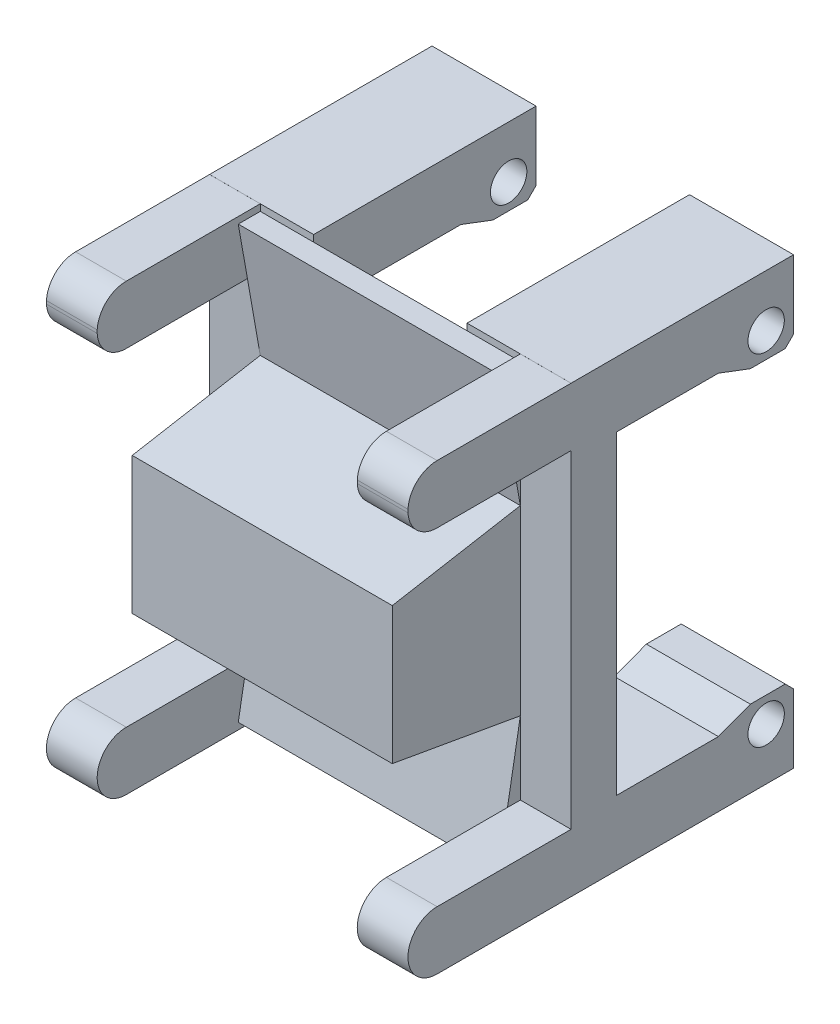
from build123d import *

# Parameters (mm, degrees)
SKETCH_1_W            = 27.8
SKETCH_1_H            = 24.2
EXTRUDE_1_DEPTH       = 5
SKETCH_5_R            = 1.4
EXTRUDE_5_DEPTH       = 8
SKETCH_8_W            = 1.5
SKETCH_8_H            = 34.2
CUT_EXTRUDE_1_DEPTH   = 30
EXTRUDE_11_DEPTH      = 10
EXTRUDE_11_DEPTH_BACK = 10
EXTRUDE_12_DEPTH      = 3.9


with BuildPart() as part:
    # 草图1 → 凸台-拉伸1 (new body)
    with BuildSketch(Plane.XY):
        Rectangle(SKETCH_1_W, SKETCH_1_H)
    extrude(amount=EXTRUDE_1_DEPTH)

    # 草图5 → 凸台-拉伸5 (add)
    # profile 1 of 2: a face of its own
    with BuildSketch(Plane.ZY.offset(13.9)):
        Polygon((-11.5, -11.168960062), (-12.967909623, -11.168960062), (-13.608884892, -11.809935331), (-13.608884892, -17.1), (-11.5, -17.1), (5, -17.1), (5, -12.1), (0, -12.1), (-7.82761802, -12.1), (-10.28681363, -11.168960062), align=None)
        with Locations((-11.5, -13.1)):
            Circle(SKETCH_5_R, mode=Mode.SUBTRACT)
    # profile 2 of 2: a face of its own
    with BuildSketch(Plane.ZY.offset(13.9)):
        Polygon((5, 12.1), (5, 17.1), (-11.5, 17.1), (-13.608884892, 17.1), (-13.608884892, 11.809935331), (-12.967909623, 11.168960062), (-11.5, 11.168960062), (-10.28681363, 11.168960062), (-7.82761802, 12.1), (0, 12.1), align=None)
        with Locations((-11.5, 13.1)):
            Circle(SKETCH_5_R, mode=Mode.SUBTRACT)
    extrude_5 = extrude(amount=-EXTRUDE_5_DEPTH)

    # 镜向1: 凸台-拉伸5 across plane
    add(extrude_5.mirror(Plane(origin=(0, 0, 0), x_dir=(0, 0, 1), z_dir=(1, 0, 0))))

    # 草图8 → 切除-拉伸1 (cut)
    with BuildSketch(Plane(origin=(13.9, 0, 0), x_dir=(0, 0, -1), z_dir=(1, 0, 0))):
        with Locations((-4.25, 0)):
            Rectangle(SKETCH_8_W, SKETCH_8_H)
    extrude(amount=-CUT_EXTRUDE_1_DEPTH, mode=Mode.SUBTRACT)

    # 草图10 → 凸台-拉伸11 (add, two sides: drawn at the far end of the back side and taken through both)
    with BuildSketch(Plane(origin=(0, 0, 0), x_dir=(0, 0, -1), z_dir=(1, 0, 0)).offset(-EXTRUDE_11_DEPTH_BACK)):
        Polygon((-3.5, -7), (-13.34807753, -5.263518223), (-13.34807753, 5.263518223), (-3.5, 7), align=None)
        Polygon((-3.5, 16.591331578), (-3.5, 7), (-5.191210538, 16.591331578), align=None)
        Polygon((-5.191210538, -16.591331578), (-3.5, -16.591331578), (-3.5, -7), align=None)
    extrude(amount=EXTRUDE_11_DEPTH + EXTRUDE_11_DEPTH_BACK)

    # 草图11 → 凸台-拉伸12 (add)
    with BuildSketch(Plane.ZY.offset(10)):
        with BuildLine():
            Line((5.191210538, 16.591331578), (4.489460182, 12.611507539))
            Line((4.489460182, 12.611507539), (13.800354116, 12.611507539))
            ThreePointArc((13.800354116, 12.611507539), (15.343887855, 13.227011755), (16.040354116, 14.735745196))
            Line((16.040354116, 14.735745196), (16.040354116, 14.973578462))
            ThreePointArc((16.040354116, 14.973578462), (15.343887855, 16.482311902), (13.800354116, 17.097816118))
            Line((13.800354116, 17.097816118), (3.5, 17.097816118))
            Line((3.5, 17.097816118), (3.5, 16.591331578))
            Line((3.5, 16.591331578), (5.191210538, 16.591331578))
        make_face()
        with BuildLine():
            Line((3.5, -17.097816118), (13.800354116, -17.097816118))
            ThreePointArc((13.800354116, -17.097816118), (16.043508405, -14.854661829), (13.800354116, -12.611507539))
            Line((13.800354116, -12.611507539), (3.5, -12.611507539))
            Line((3.5, -12.611507539), (3.5, -17.097816118))
        make_face()
        Polygon((3.5, 16.591331578), (3.5, 12.611507539), (4.489460182, 12.611507539), (5.191210538, 16.591331578), align=None)
    extrude_12 = extrude(amount=EXTRUDE_12_DEPTH)

    # 镜向3: 凸台-拉伸12 across plane
    add(extrude_12.mirror(Plane(origin=(0, 0, 0), x_dir=(0, 0, 1), z_dir=(1, 0, 0))))


solid = part.part
